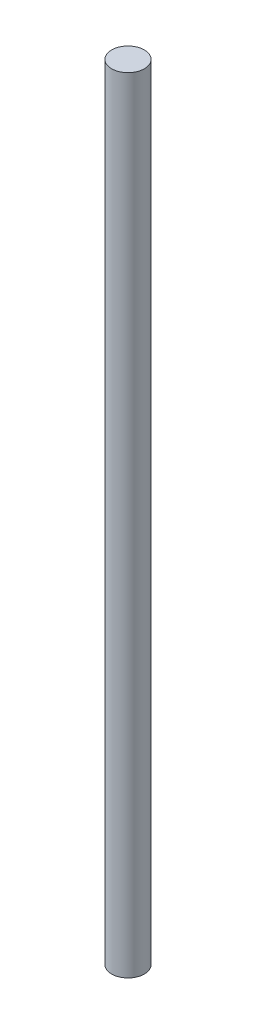
from build123d import *

# Parameters (mm, degrees)
SKETCH1_R           = 3.175
BOSS_EXTRUDE1_DEPTH = 152.4


with BuildPart() as part:
    # Sketch1 → Boss-Extrude1 (new body)
    with BuildSketch(Plane(origin=(0, 0, 0), x_dir=(1, 0, 0), z_dir=(0, 1, 0))):
        with Locations(Location((0, 0, 0), (0, 0, 90))):
            Circle(SKETCH1_R)
    extrude(amount=BOSS_EXTRUDE1_DEPTH)


solid = part.part
